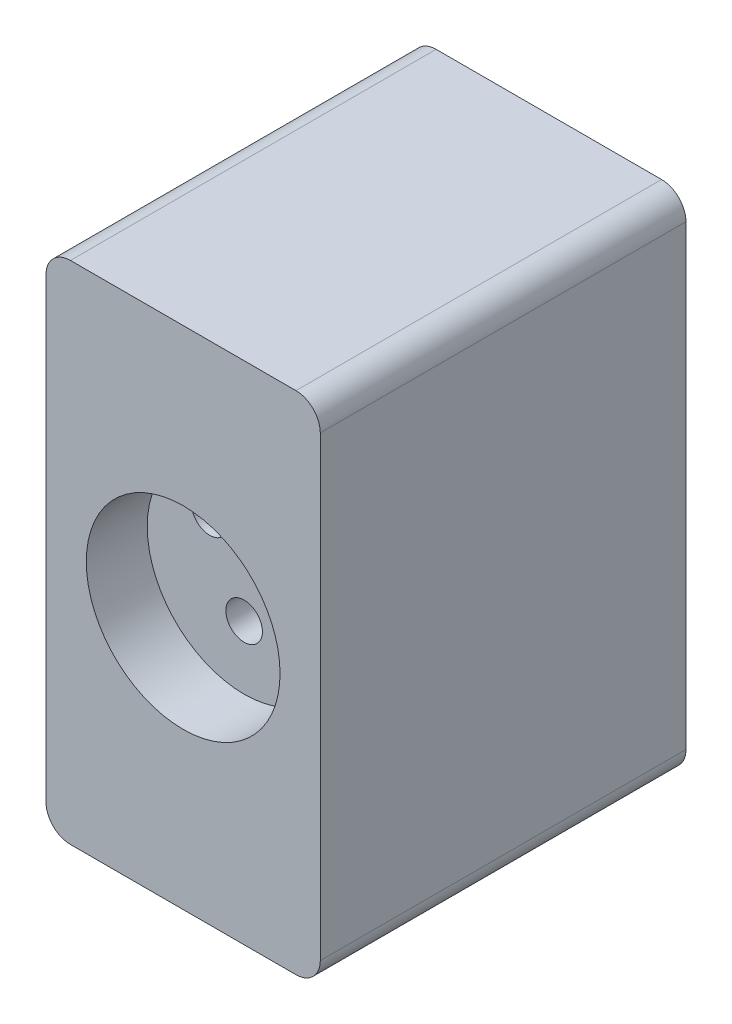
from build123d import *

# Parameters (mm, degrees)
BOSS_EXTRUDE1_DEPTH = 60
SKETCH3_R           = 15.895839237
CUT_EXTRUDE1_DEPTH  = 10
SKETCH4_R           = 3
CUT_EXTRUDE2_DEPTH  = 40


with BuildPart() as part:
    # Sketch2 → Boss-Extrude1 (new body)
    with BuildSketch(Plane.XY):
        with BuildLine():
            Line((-18.5, -41.5), (18.5, -41.5))
            ThreePointArc((18.5, -41.5), (21.328427125, -40.328427125), (22.5, -37.5))
            Line((22.5, -37.5), (22.5, 37.5))
            ThreePointArc((22.5, 37.5), (21.328427125, 40.328427125), (18.5, 41.5))
            Line((18.5, 41.5), (-18.5, 41.5))
            ThreePointArc((-18.5, 41.5), (-21.328427125, 40.328427125), (-22.5, 37.5))
            Line((-22.5, 37.5), (-22.5, -37.5))
            ThreePointArc((-22.5, -37.5), (-21.328427125, -40.328427125), (-18.5, -41.5))
        make_face()
    extrude(amount=BOSS_EXTRUDE1_DEPTH)

    # Sketch3 → Cut-Extrude1 (cut)
    with BuildSketch(Plane.XY.offset(60)):
        Circle(SKETCH3_R)
    extrude(amount=-CUT_EXTRUDE1_DEPTH, mode=Mode.SUBTRACT)

    # Sketch4 → Cut-Extrude2 (cut)
    with BuildSketch(Plane.XY.offset(50)):
        with Locations((7.338844811, 6.864557304)):
            Circle(SKETCH4_R)
        with Locations((-5.644149057, 6.864557304)):
            Circle(SKETCH4_R)
        with Locations((0, -5.510422777)):
            Circle(SKETCH4_R)
    extrude(amount=-CUT_EXTRUDE2_DEPTH, mode=Mode.SUBTRACT)


solid = part.part
